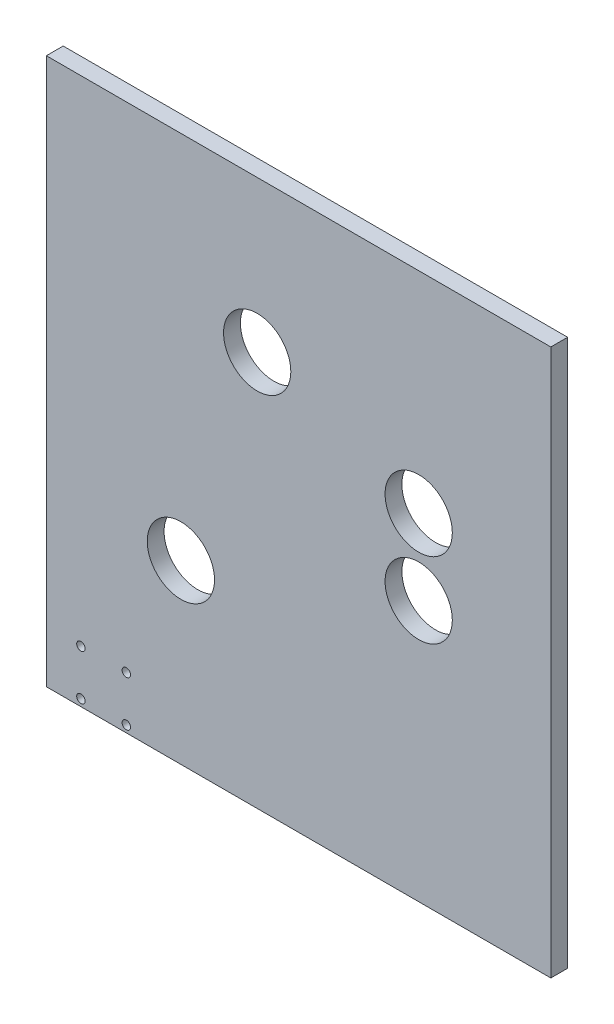
from build123d import *

# Parameters (mm, degrees)
SKETCH_1_W          = 300
SKETCH_1_H          = 300
EXTRUDE_1_DEPTH     = 10
SKETCH_2_R          = 20
CUT_EXTRUDE_1_DEPTH = 213.367605816
SKETCH_5_W          = 300
SKETCH_5_H          = 10
EXTRUDE_2_DEPTH     = 25
SKETCH_7_R          = 2.5
CUT_EXTRUDE_5_DEPTH = 231.705439901


with BuildPart() as part:
    # 草图1 → 凸台-拉伸1 (new body)
    with BuildSketch(Plane.XY):
        Rectangle(SKETCH_1_W, SKETCH_1_H)
    extrude(amount=EXTRUDE_1_DEPTH)

    # 草图2 → 切除-拉伸1 (cut, through all)
    with BuildSketch(Plane.XY.offset(10)):
        with Locations((-70, -70)):
            Circle(SKETCH_2_R)
        with Locations((71.421356237, -20)):
            Circle(SKETCH_2_R)
        with Locations((-24.625507324, 60)):
            Circle(SKETCH_2_R)
        with Locations((71.421356237, 25)):
            Circle(SKETCH_2_R)
    extrude(amount=-CUT_EXTRUDE_1_DEPTH, mode=Mode.SUBTRACT)

    # 草图5 → 凸台-拉伸2 (add)
    with BuildSketch(Plane.XZ.offset(150)):
        with Locations((0, 5)):
            Rectangle(SKETCH_5_W, SKETCH_5_H)
    extrude(amount=EXTRUDE_2_DEPTH)

    # 草图7 → 切除-拉伸5 (cut, through all)
    with BuildSketch(Plane(origin=(0, 0, 0), x_dir=(-1, 0, 0), z_dir=(0, 0, -1))):
        with Locations((129.453643763, -143.875)):
            Circle(SKETCH_7_R)
        with Locations((102.453643763, -143.875)):
            Circle(SKETCH_7_R)
        with Locations((129.453643763, -170.875)):
            Circle(SKETCH_7_R)
        with Locations((102.453643763, -170.875)):
            Circle(SKETCH_7_R)
    extrude(amount=-CUT_EXTRUDE_5_DEPTH, mode=Mode.SUBTRACT)


solid = part.part
